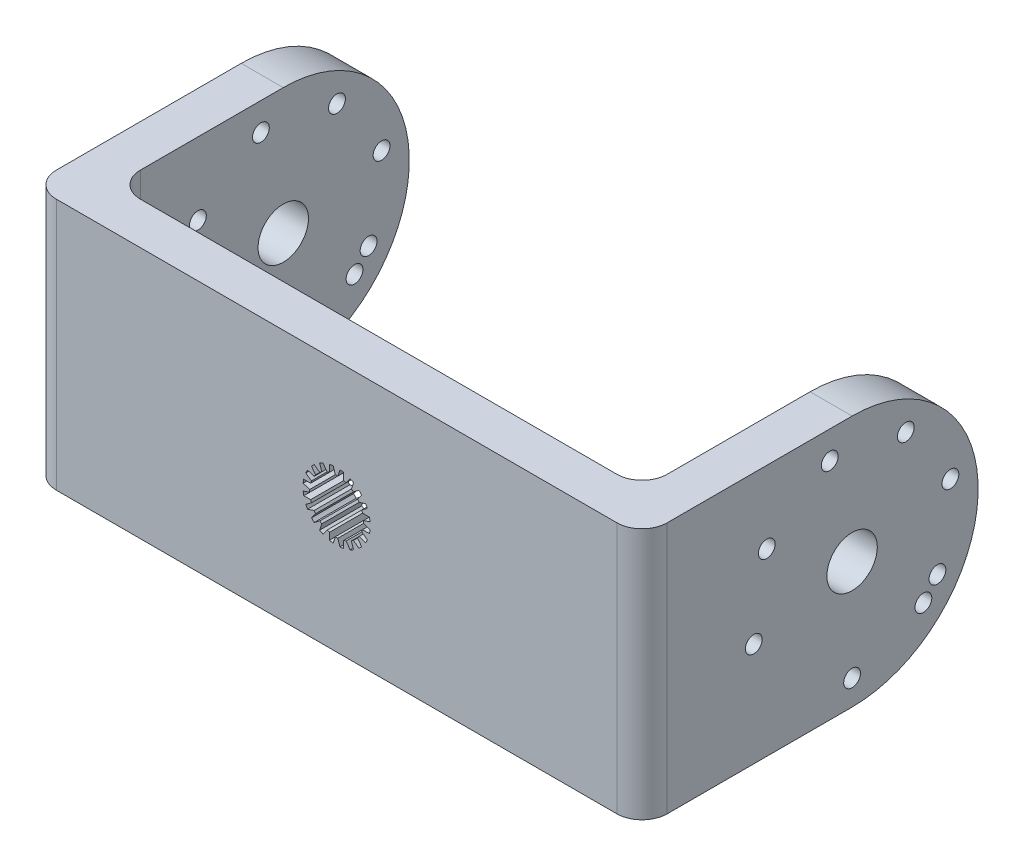
from build123d import *

# Parameters (mm, degrees)
BOSS_EXTRUDE1_DEPTH = 5
SKETCH4_W           = 5
SKETCH4_H           = 30
BOSS_EXTRUDE4_DEPTH = 35
SKETCH5_R           = 3
CUT_EXTRUDE2_DEPTH  = 40
CUT_EXTRUDE3_DEPTH  = 10
SKETCH7_R           = 1
SKETCH7_R_2         = 1.000000019
CUT_EXTRUDE4_DEPTH  = 10
FILLET2_R           = 3
FILLET3_R           = 3
FILLET5_R           = 3
FILLET6_R           = 3
CUT_EXTRUDE5_DEPTH  = 5


with BuildPart() as part:
    # Sketch1 → Boss-Extrude1 (new body)
    with BuildSketch(Plane.XY):
        with BuildLine():
            Line((5, 0), (36.35, 0))
            Line((36.35, 0), (36.35, 15))
            Line((36.35, 15), (-36.35, 15))
            Line((-36.35, 15), (-36.35, 0))
            Line((-36.35, 0), (-5, 0))
            ThreePointArc((-5, 0), (0, 5), (5, 0))
        make_face()
        with BuildLine():
            ThreePointArc((-5, 0), (0, -5), (5, 0))
            Line((5, 0), (0, 0))
            Line((0, 0), (-5, 0))
        make_face()
        with BuildLine():
            Line((0, 0), (5, 0))
            ThreePointArc((5, 0), (0, 5), (-5, 0))
            Line((-5, 0), (0, 0))
        make_face()
        with BuildLine():
            Line((-36.35, -15), (36.35, -15))
            Line((36.35, -15), (36.35, 0))
            Line((36.35, 0), (5, 0))
            ThreePointArc((5, 0), (0, -5), (-5, 0))
            Line((-5, 0), (-36.35, 0))
            Line((-36.35, 0), (-36.35, -15))
        make_face()
    extrude(amount=BOSS_EXTRUDE1_DEPTH)

    # Sketch4 → Boss-Extrude4 (add)
    with BuildSketch(Plane(origin=(0, 0, 0), x_dir=(-1, 0, 0), z_dir=(0, 0, -1))):
        with Locations((-33.85, 0)):
            Rectangle(SKETCH4_W, SKETCH4_H)
    boss_extrude4 = extrude(amount=BOSS_EXTRUDE4_DEPTH)

    # Sketch5 → Cut-Extrude2 (cut)
    with BuildSketch(Plane(origin=(36.35, 0, 0), x_dir=(0, 0, -1), z_dir=(1, 0, 0))):
        with Locations(Location((20, 0, 0), (0, 0, 90))):
            Circle(SKETCH5_R)
    cut_extrude2 = extrude(amount=-CUT_EXTRUDE2_DEPTH, mode=Mode.SUBTRACT)

    # Sketch6 → Cut-Extrude3 (cut)
    with BuildSketch(Plane.ZY.offset(-31.35)):
        with BuildLine():
            ThreePointArc((-35, 0), (-30.606601718, 10.606601718), (-20, 15))
            Line((-20, 15), (-35, 15))
            Line((-35, 15), (-35, 0))
        make_face()
        with BuildLine():
            ThreePointArc((-20, -15), (-30.606601718, -10.606601718), (-35, 0))
            Line((-35, 0), (-35, -15))
            Line((-35, -15), (-20, -15))
        make_face()
    cut_extrude3 = extrude(amount=-CUT_EXTRUDE3_DEPTH, mode=Mode.SUBTRACT)

    # Sketch7 → Cut-Extrude4 (cut)
    with BuildSketch(Plane.ZY.offset(-31.35)):
        with Locations((-31.701517916, 2.659789178)):
            Circle(SKETCH7_R)
        with Locations((-17.340210822, 11.701517916)):
            Circle(SKETCH7_R)
        with Locations((-9.845022367, 6.393467704)):
            Circle(SKETCH7_R)
        with Locations((-30.154977622, -6.393467721)):
            Circle(SKETCH7_R_2)
        with Locations((-8.298482084, -2.659789178)):
            Circle(SKETCH7_R)
        with Locations((-26.393467704, 10.154977633)):
            Circle(SKETCH7_R)
        with Locations((-28.485281374, -8.485281374)):
            Circle(SKETCH7_R)
        with Locations((-20, -12)):
            Circle(SKETCH7_R)
    cut_extrude4 = extrude(amount=-CUT_EXTRUDE4_DEPTH, mode=Mode.SUBTRACT)

    # Fillet2
    fillet2_edges = [part.edges().sort_by_distance(p)[0] for p in [
        (36.35, 0, 5),
    ]]
    fillet(fillet2_edges, radius=FILLET2_R)

    # Fillet3
    fillet3_edges = [part.edges().sort_by_distance(p)[0] for p in [
        (31.35, 0, 0),
    ]]
    fillet(fillet3_edges, radius=FILLET3_R)

    # Mirror2: Boss-Extrude4, Cut-Extrude2, Cut-Extrude3, Cut-Extrude4 across plane
    add(boss_extrude4.mirror(Plane(origin=(0, 0, 0), x_dir=(0, 0, 1), z_dir=(1, 0, 0))))
    add(cut_extrude2.mirror(Plane(origin=(0, 0, 0), x_dir=(0, 0, 1), z_dir=(1, 0, 0))), mode=Mode.SUBTRACT)
    add(cut_extrude3.mirror(Plane(origin=(0, 0, 0), x_dir=(0, 0, 1), z_dir=(1, 0, 0))), mode=Mode.SUBTRACT)
    add(cut_extrude4.mirror(Plane(origin=(0, 0, 0), x_dir=(0, 0, 1), z_dir=(1, 0, 0))), mode=Mode.SUBTRACT)

    # Fillet5
    fillet5_edges = [part.edges().sort_by_distance(p)[0] for p in [
        (-36.35, 0, 5),
    ]]
    fillet(fillet5_edges, radius=FILLET5_R)

    # Fillet6
    fillet6_edges = [part.edges().sort_by_distance(p)[0] for p in [
        (-31.35, 0, 0),
    ]]
    fillet(fillet6_edges, radius=FILLET6_R)

    # Sketch9 → Cut-Extrude5 (cut)
    with BuildSketch(Plane.XY.offset(5)):
        with BuildLine():
            Line((3.977595735, 0.406889685), (3.197645987, 0.156889685))
            Line((3.197645987, 0.156889685), (3.197645987, -0.143110315))
            Line((3.197645987, -0.143110315), (3.977595735, -0.393110315))
            ThreePointArc((3.977595735, -0.393110315), (3.948399349, -0.618848175), (3.906409927, -0.842559818))
            Line((3.906409927, -0.842559818), (3.087379388, -0.83930622))
            Line((3.087379388, -0.83930622), (2.99467429, -1.124623174))
            Line((2.99467429, -1.124623174), (3.659196332, -1.603405031))
            ThreePointArc((3.659196332, -1.603405031), (3.561672083, -1.809072314), (3.452607071, -2.008859284))
            Line((3.452607071, -2.008859284), (2.674668157, -1.752670573))
            Line((2.674668157, -1.752670573), (2.498332581, -1.995375672))
            Line((2.498332581, -1.995375672), (2.982378869, -2.65607288))
            ThreePointArc((2.982378869, -2.65607288), (2.826073111, -2.82153744), (2.660608551, -2.977843197))
            Line((2.660608551, -2.977843197), (1.999911343, -2.493796909))
            Line((1.999911343, -2.493796909), (1.757206245, -2.670132485))
            Line((1.757206245, -2.670132485), (2.013394956, -3.448071399))
            ThreePointArc((2.013394956, -3.448071399), (1.813607986, -3.557136412), (1.607940702, -3.65466066))
            Line((1.607940702, -3.65466066), (1.129158846, -2.990138618))
            Line((1.129158846, -2.990138618), (0.843841891, -3.082843716))
            Line((0.843841891, -3.082843716), (0.847095489, -3.901874256))
            ThreePointArc((0.847095489, -3.901874256), (0.623383847, -3.943863677), (0.397645987, -3.973060063))
            Line((0.397645987, -3.973060063), (0.147645987, -3.193110315))
            Line((0.147645987, -3.193110315), (-0.152354013, -3.193110315))
            Line((-0.152354013, -3.193110315), (-0.402354013, -3.973060063))
            ThreePointArc((-0.402354013, -3.973060063), (-0.628091873, -3.943863677), (-0.851803516, -3.901874256))
            Line((-0.851803516, -3.901874256), (-0.848549918, -3.082843716))
            Line((-0.848549918, -3.082843716), (-1.133866873, -2.990138618))
            Line((-1.133866873, -2.990138618), (-1.612648729, -3.65466066))
            ThreePointArc((-1.612648729, -3.65466066), (-1.818316012, -3.557136412), (-2.018102983, -3.448071399))
            Line((-2.018102983, -3.448071399), (-1.761914272, -2.670132485))
            Line((-1.761914272, -2.670132485), (-2.00461937, -2.493796909))
            Line((-2.00461937, -2.493796909), (-2.665316578, -2.977843197))
            ThreePointArc((-2.665316578, -2.977843197), (-2.830781138, -2.82153744), (-2.987086896, -2.65607288))
            Line((-2.987086896, -2.65607288), (-2.503040607, -1.995375672))
            Line((-2.503040607, -1.995375672), (-2.679376183, -1.752670573))
            Line((-2.679376183, -1.752670573), (-3.457315097, -2.008859284))
            ThreePointArc((-3.457315097, -2.008859284), (-3.56638011, -1.809072314), (-3.663904358, -1.603405031))
            Line((-3.663904358, -1.603405031), (-2.999382316, -1.124623174))
            Line((-2.999382316, -1.124623174), (-3.092087415, -0.83930622))
            Line((-3.092087415, -0.83930622), (-3.911117954, -0.842559818))
            ThreePointArc((-3.911117954, -0.842559818), (-3.953107376, -0.618848175), (-3.982303762, -0.393110315))
            Line((-3.982303762, -0.393110315), (-3.202354013, -0.143110315))
            Line((-3.202354013, -0.143110315), (-3.202354013, 0.156889685))
            Line((-3.202354013, 0.156889685), (-3.982303762, 0.406889685))
            ThreePointArc((-3.982303762, 0.406889685), (-3.953107376, 0.632627545), (-3.911117954, 0.856339187))
            Line((-3.911117954, 0.856339187), (-3.092087415, 0.85308559))
            Line((-3.092087415, 0.85308559), (-2.999382316, 1.138402544))
            Line((-2.999382316, 1.138402544), (-3.663904358, 1.617184401))
            ThreePointArc((-3.663904358, 1.617184401), (-3.56638011, 1.822851684), (-3.457315097, 2.022638654))
            Line((-3.457315097, 2.022638654), (-2.679376183, 1.766449943))
            Line((-2.679376183, 1.766449943), (-2.503040607, 2.009155041))
            Line((-2.503040607, 2.009155041), (-2.987086896, 2.66985225))
            ThreePointArc((-2.987086896, 2.66985225), (-2.830781138, 2.83531681), (-2.665316578, 2.991622567))
            Line((-2.665316578, 2.991622567), (-2.00461937, 2.507576279))
            Line((-2.00461937, 2.507576279), (-1.761914272, 2.683911855))
            Line((-1.761914272, 2.683911855), (-2.018102983, 3.461850769))
            ThreePointArc((-2.018102983, 3.461850769), (-1.818316012, 3.570915782), (-1.612648729, 3.66844003))
            Line((-1.612648729, 3.66844003), (-1.133866873, 3.003917988))
            Line((-1.133866873, 3.003917988), (-0.848549918, 3.096623086))
            Line((-0.848549918, 3.096623086), (-0.851803516, 3.915653625))
            ThreePointArc((-0.851803516, 3.915653625), (-0.628091873, 3.957643047), (-0.402354013, 3.986839433))
            Line((-0.402354013, 3.986839433), (-0.152354013, 3.206889685))
            Line((-0.152354013, 3.206889685), (0.147645987, 3.206889685))
            Line((0.147645987, 3.206889685), (0.397645987, 3.986839433))
            ThreePointArc((0.397645987, 3.986839433), (0.623383847, 3.957643047), (0.847095489, 3.915653625))
            Line((0.847095489, 3.915653625), (0.843841891, 3.096623086))
            Line((0.843841891, 3.096623086), (1.129158846, 3.003917988))
            Line((1.129158846, 3.003917988), (1.607940702, 3.66844003))
            ThreePointArc((1.607940702, 3.66844003), (1.813607986, 3.570915782), (2.013394956, 3.461850769))
            Line((2.013394956, 3.461850769), (1.757206245, 2.683911855))
            Line((1.757206245, 2.683911855), (1.999911343, 2.507576279))
            Line((1.999911343, 2.507576279), (2.660608551, 2.991622567))
            ThreePointArc((2.660608551, 2.991622567), (2.826073111, 2.83531681), (2.982378869, 2.66985225))
            Line((2.982378869, 2.66985225), (2.498332581, 2.009155041))
            Line((2.498332581, 2.009155041), (2.674668157, 1.766449943))
            Line((2.674668157, 1.766449943), (3.452607071, 2.022638654))
            ThreePointArc((3.452607071, 2.022638654), (3.561672083, 1.822851684), (3.659196332, 1.617184401))
            Line((3.659196332, 1.617184401), (2.99467429, 1.138402544))
            Line((2.99467429, 1.138402544), (3.087379388, 0.85308559))
            Line((3.087379388, 0.85308559), (3.906409927, 0.856339187))
            ThreePointArc((3.906409927, 0.856339187), (3.948399349, 0.632627545), (3.977595735, 0.406889685))
        make_face()
    extrude(amount=-CUT_EXTRUDE5_DEPTH, mode=Mode.SUBTRACT)


solid = part.part
